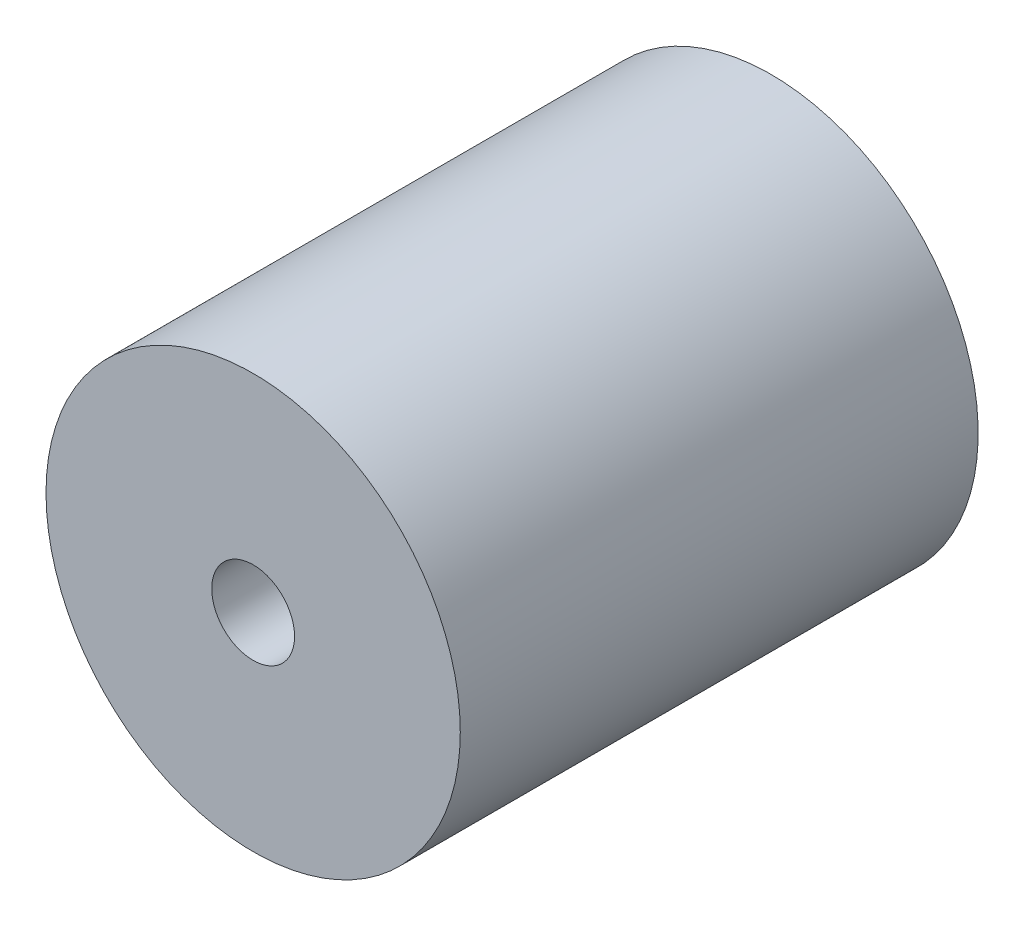
from build123d import *

# Parameters (mm, degrees)
SKETCH1_R           = 10
SKETCH1_R_2         = 2
BOSS_EXTRUDE1_DEPTH = 10
BOSS_EXTRUDE3_START = 5
SKETCH4_R           = 10
BOSS_EXTRUDE3_DEPTH = 5
BOSS_EXTRUDE4_START = 10
SKETCH5_R           = 10
SKETCH5_R_2         = 2
BOSS_EXTRUDE4_DEPTH = 10


with BuildPart() as part:
    # Sketch1 → Boss-Extrude1 (new body)
    with BuildSketch(Plane.XY):
        Circle(SKETCH1_R)
        Circle(SKETCH1_R_2, mode=Mode.SUBTRACT)
    extrude(amount=BOSS_EXTRUDE1_DEPTH)

    # Sketch4 → Boss-Extrude3 (add)
    with BuildSketch(Plane(origin=(0, 0, 0), x_dir=(-1, 0, 0), z_dir=(0, 0, -1)).offset(BOSS_EXTRUDE3_START)):
        Circle(SKETCH4_R)
    extrude(amount=-BOSS_EXTRUDE3_DEPTH)

    # Sketch5 → Boss-Extrude4 (add)
    with BuildSketch(Plane(origin=(0, 0, -5), x_dir=(-1, 0, 0), z_dir=(0, 0, -1)).offset(BOSS_EXTRUDE4_START)):
        Circle(SKETCH5_R)
        with Locations(Location((0, 0, 0), (0, 0, 180))):
            Circle(SKETCH5_R_2, mode=Mode.SUBTRACT)
    extrude(amount=-BOSS_EXTRUDE4_DEPTH)


solid = part.part
